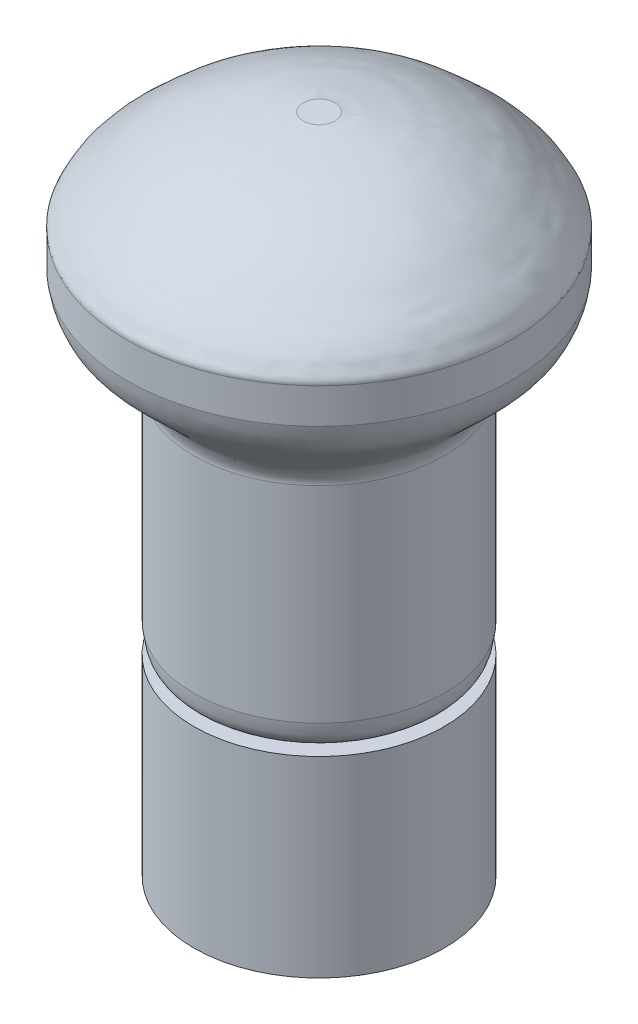
from build123d import *


with BuildPart() as part:
    # Sketch1 → Revolve5 (revolve)
    with BuildSketch(Plane(origin=(0, 0, 0), x_dir=(0, 0, -1), z_dir=(1, 0, 0)), mode=Mode.PRIVATE) as revolve5_sk:
        with BuildLine():
            Line((26.0877562, 274.977978152), (26.0877562, 232.119517882))
            add(Edge.make_bspline(
                [(21.644222638, 226.099267925), (21.958350781, 226.150905548), (22.404904398, 226.152975164), (22.895958822, 226.332084554), (23.440030786, 226.749372055), (24.24430563, 227.201358343), (25.006598671, 227.972439803), (25.579605023, 228.952220985), (25.862222604, 230.393042058), (26.02282064, 231.443642052), (26.0877562, 232.119517882)],
                knots=[0, 0, 0, 0, 0.091924004, 0.112491347, 0.205673428, 0.333713758, 0.459267324, 0.60242293, 0.748839041, 1, 1, 1, 1], degree=3))
            Line((21.644222638, 226.099267925), (26.0877562, 226.099267925))
            Line((26.0877562, 226.099267925), (26.0877562, 186.115239509))
            Line((26.0877562, 186.115239509), (0, 186.115239509))
            Line((0, 186.115239509), (0, 324))
            Line((0, 324), (3.296807109, 324.000001326))
            add(Edge.make_bspline(
                [(3.296807109, 324.000001326), (4.197169533, 323.839631011), (5.699030772, 323.815957427), (7.693496909, 323.429691693), (9.272215479, 323.156322342), (10.750690756, 322.85377071), (12.181632664, 322.557718535), (13.637151846, 322.313021034), (14.864343001, 321.911666772), (15.911496119, 321.566233217), (16.810008215, 321.249118961), (17.733867067, 321.014944924), (18.837916963, 320.64163427), (19.930975123, 320.193493737), (21.068588771, 319.694847201), (22.140955467, 319.262699902), (23.215588995, 318.685639732), (24.437095613, 318.116319481), (25.676203543, 317.35184267), (27.106557761, 316.751797909), (28.431792952, 315.783230305), (29.732159344, 314.893883423), (31.057969832, 313.930025749), (32.195938479, 312.858119022), (33.337791918, 311.850348536), (34.453883476, 310.964611829), (35.389537529, 309.886673636), (36.507817894, 309.094911082), (37.294189805, 308.020839774), (38.123272117, 307.123784158), (38.90481731, 306.096129676), (39.472447784, 304.634911321), (40.277373116, 303.734041187), (40.135001067, 302.929125624)],
                knots=[0, 0, 0, 0, 0.061584866, 0.100794934, 0.136830737, 0.169700169, 0.202568951, 0.235437772, 0.269088289, 0.28947253, 0.309858246, 0.333318895, 0.353706299, 0.388422524, 0.412964696, 0.437513728, 0.466339543, 0.495168077, 0.528353595, 0.56438738, 0.599250154, 0.638593117, 0.670823767, 0.709635236, 0.743897498, 0.773611537, 0.805518574, 0.839782544, 0.864952923, 0.894669658, 0.922394752, 0.951224044, 1, 1, 1, 1], degree=3))
            Line((40.135001067, 302.929125624), (40.135001067, 295.618823674))
            add(Edge.make_bspline(
                [(40.135001067, 295.618823674), (39.963585575, 294.713139617), (39.786893551, 293.368854611), (39.10947692, 291.690071062), (38.601855291, 290.459886772), (37.841755018, 289.239215664), (36.919500435, 288.227943295), (35.923208467, 287.26510185), (34.974047306, 286.251458489), (33.831062374, 285.346264323), (32.823255368, 284.296585872), (31.870131948, 283.286750944), (30.766815667, 282.438718878), (29.874182206, 281.464372876), (28.860414421, 280.515150439), (28.056699811, 279.511909602), (27.143781617, 278.556908896), (26.496830662, 277.02873066), (26.008069584, 275.856710536), (26.0877562, 274.977978152)],
                knots=[0, 0, 0, 0, 0.108355708, 0.156009902, 0.210945136, 0.263562196, 0.322855399, 0.37018587, 0.425399507, 0.484692346, 0.539908976, 0.595125988, 0.646549262, 0.701764349, 0.749092889, 0.808384474, 0.85194968, 0.901837269, 1, 1, 1, 1], degree=3))
        make_face()
    revolve(revolve5_sk.sketch.rotate(Axis((0, 324, 0), (0, -1, 0)), 180), axis=Axis((0, 324, 0), (0, -1, 0)))


solid = part.part
